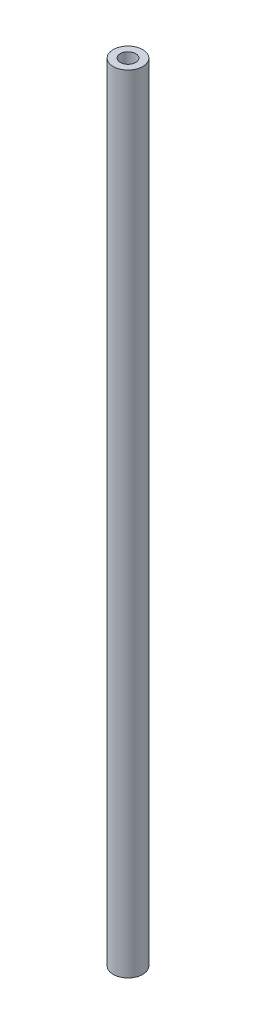
from build123d import *

# Parameters (mm, degrees)
SKETCH1_R                  = 4.7625
BOSS_EXTRUDE1_DEPTH        = 254
F_10_CLEARANCE_HOLE1_D     = 4.9784
F_10_CLEARANCE_HOLE1_DEPTH = 2059.43
F_10_CLEARANCE_HOLE1_TIP   = 1.495662253


with BuildPart() as part:
    # Sketch1 → Boss-Extrude1 (new body)
    with BuildSketch(Plane(origin=(0, 0, 0), x_dir=(1, 0, 0), z_dir=(0, 1, 0))):
        with Locations(Location((0, 0, 0), (0, 0, 270))):
            Circle(SKETCH1_R)
    extrude(amount=BOSS_EXTRUDE1_DEPTH)

    # #10 Clearance Hole1
    with Locations(Plane(origin=(0, 254, 0), x_dir=(-1, 0, 0), z_dir=(0, 1, 0))):
        with Locations((0, 0)):
            Hole(F_10_CLEARANCE_HOLE1_D / 2, depth=F_10_CLEARANCE_HOLE1_DEPTH)
            with Locations((0, 0, -(F_10_CLEARANCE_HOLE1_DEPTH + F_10_CLEARANCE_HOLE1_TIP / 2))):  # 118° drill point
                Cone(0, F_10_CLEARANCE_HOLE1_D / 2, F_10_CLEARANCE_HOLE1_TIP, mode=Mode.SUBTRACT)


solid = part.part
